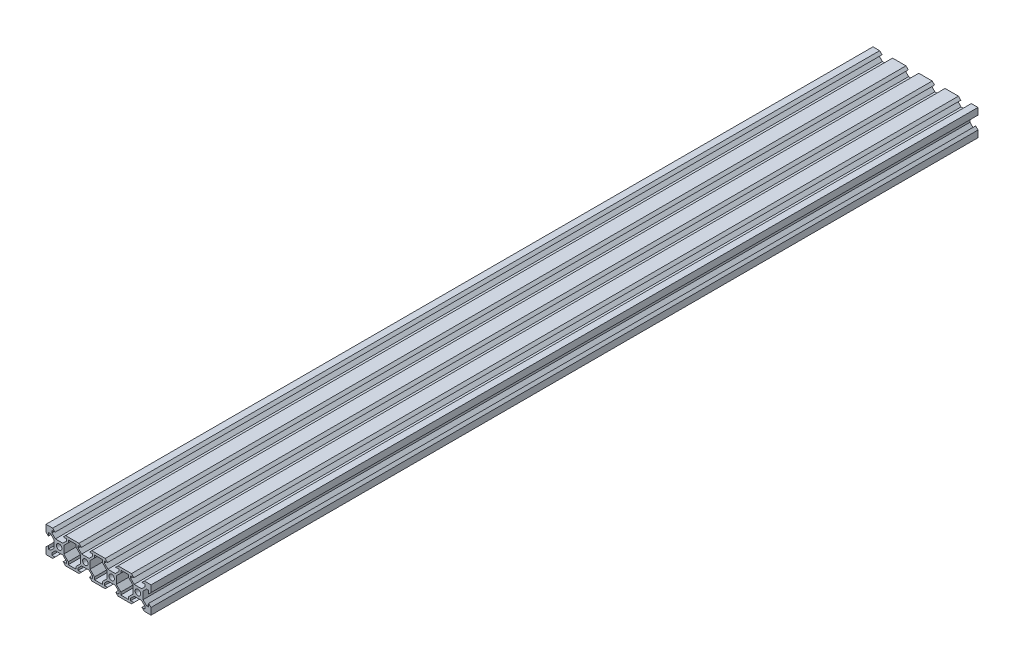
from build123d import *

# Parameters (mm, degrees)
ESQUISSE1_W             = 80
ESQUISSE1_H             = 20
BOSS_EXTRU_1_DEPTH      = 630
ENL_V_MAT_EXTRU_1_REACH = 635.518
ESQUISSE2_R             = 2.1
ENL_V_MAT_EXTRU_2_REACH = 635.518


with BuildPart() as part:
    # Esquisse1 → Boss.-Extru.1 (new body)
    with BuildSketch(Plane.XY):
        with Locations((-25.62771875, -1.733873274)):
            Rectangle(ESQUISSE1_W, ESQUISSE1_H)
    extrude(amount=BOSS_EXTRU_1_DEPTH)

    # Esquisse2 → Enlèv. mat.-Extru.1 (cut, up to next)
    with BuildSketch(Plane(origin=(0, 0, 0), x_dir=(-1, 0, 0), z_dir=(0, 0, -1)), mode=Mode.PRIVATE) as enl_v_mat_extru_1_sk1:
        with Locations((55.62771875, -1.733873274)):
            Circle(ESQUISSE2_R)
    enl_v_mat_extru_1_tool1 = extrude(enl_v_mat_extru_1_sk1.sketch, amount=-ENL_V_MAT_EXTRU_1_REACH, mode=Mode.PRIVATE) & part.part
    # Esquisse2 → Enlèv. mat.-Extru.1 (cut, up to next)
    with BuildSketch(Plane(origin=(0, 0, 0), x_dir=(-1, 0, 0), z_dir=(0, 0, -1)), mode=Mode.PRIVATE) as enl_v_mat_extru_1_sk2:
        with Locations((35.62771875, -1.733873274)):
            Circle(ESQUISSE2_R)
    enl_v_mat_extru_1_tool2 = extrude(enl_v_mat_extru_1_sk2.sketch, amount=-ENL_V_MAT_EXTRU_1_REACH, mode=Mode.PRIVATE) & part.part
    # Esquisse2 → Enlèv. mat.-Extru.1 (cut, up to next)
    with BuildSketch(Plane(origin=(0, 0, 0), x_dir=(-1, 0, 0), z_dir=(0, 0, -1)), mode=Mode.PRIVATE) as enl_v_mat_extru_1_sk3:
        with Locations((15.62771875, -1.733873274)):
            Circle(ESQUISSE2_R)
    enl_v_mat_extru_1_tool3 = extrude(enl_v_mat_extru_1_sk3.sketch, amount=-ENL_V_MAT_EXTRU_1_REACH, mode=Mode.PRIVATE) & part.part
    # Esquisse2 → Enlèv. mat.-Extru.1 (cut, up to next)
    with BuildSketch(Plane(origin=(0, 0, 0), x_dir=(-1, 0, 0), z_dir=(0, 0, -1)), mode=Mode.PRIVATE) as enl_v_mat_extru_1_sk4:
        with Locations((-4.37228125, -1.733873274)):
            Circle(ESQUISSE2_R)
    enl_v_mat_extru_1_tool4 = extrude(enl_v_mat_extru_1_sk4.sketch, amount=-ENL_V_MAT_EXTRU_1_REACH, mode=Mode.PRIVATE) & part.part
    # Esquisse2 → Enlèv. mat.-Extru.1 (cut, up to next)
    with BuildSketch(Plane(origin=(0, 0, 0), x_dir=(-1, 0, 0), z_dir=(0, 0, -1)), mode=Mode.PRIVATE) as enl_v_mat_extru_1_sk5:
        Polygon((50.72771875, 8.266126726), (60.52771875, 8.266126726), (58.72771875, 6.466126726), (61.12771875, 6.466126726), (61.12771875, 4.826126726), (58.46771875, 2.166126726), (52.78771875, 2.166126726), (50.12771875, 4.826126726), (50.12771875, 6.466126726), (52.52771875, 6.466126726), align=None)
    enl_v_mat_extru_1_tool5 = extrude(enl_v_mat_extru_1_sk5.sketch, amount=-ENL_V_MAT_EXTRU_1_REACH, mode=Mode.PRIVATE) & part.part
    # Esquisse2 → Enlèv. mat.-Extru.1 (cut, up to next)
    with BuildSketch(Plane(origin=(0, 0, 0), x_dir=(-1, 0, 0), z_dir=(0, 0, -1)), mode=Mode.PRIVATE) as enl_v_mat_extru_1_sk6:
        Polygon((65.62771875, 3.166126726), (65.62771875, -6.633873274), (63.82771875, -4.833873274), (63.82771875, -7.233873274), (62.18771875, -7.233873274), (59.52771875, -4.573873274), (59.52771875, 1.106126726), (62.18771875, 3.766126726), (63.82771875, 3.766126726), (63.82771875, 1.366126726), align=None)
    enl_v_mat_extru_1_tool6 = extrude(enl_v_mat_extru_1_sk6.sketch, amount=-ENL_V_MAT_EXTRU_1_REACH, mode=Mode.PRIVATE) & part.part
    # Esquisse2 → Enlèv. mat.-Extru.1 (cut, up to next)
    with BuildSketch(Plane(origin=(0, 0, 0), x_dir=(-1, 0, 0), z_dir=(0, 0, -1)), mode=Mode.PRIVATE) as enl_v_mat_extru_1_sk7:
        Polygon((60.52771875, -11.733873274), (50.72771875, -11.733873274), (52.52771875, -9.933873274), (50.12771875, -9.933873274), (50.12771875, -8.293873274), (52.78771875, -5.633873274), (58.46771875, -5.633873274), (61.12771875, -8.293873274), (61.12771875, -9.933873274), (58.72771875, -9.933873274), align=None)
    enl_v_mat_extru_1_tool7 = extrude(enl_v_mat_extru_1_sk7.sketch, amount=-ENL_V_MAT_EXTRU_1_REACH, mode=Mode.PRIVATE) & part.part
    # Esquisse2 → Enlèv. mat.-Extru.1 (cut, up to next)
    with BuildSketch(Plane(origin=(0, 0, 0), x_dir=(-1, 0, 0), z_dir=(0, 0, -1)), mode=Mode.PRIVATE) as enl_v_mat_extru_1_sk8:
        Polygon((30.72771875, 8.266126726), (40.52771875, 8.266126726), (38.72771875, 6.466126726), (41.12771875, 6.466126726), (41.12771875, 4.826126726), (38.46771875, 2.166126726), (32.78771875, 2.166126726), (30.12771875, 4.826126726), (30.12771875, 6.466126726), (32.52771875, 6.466126726), align=None)
    enl_v_mat_extru_1_tool8 = extrude(enl_v_mat_extru_1_sk8.sketch, amount=-ENL_V_MAT_EXTRU_1_REACH, mode=Mode.PRIVATE) & part.part
    # Esquisse2 → Enlèv. mat.-Extru.1 (cut, up to next)
    with BuildSketch(Plane(origin=(0, 0, 0), x_dir=(-1, 0, 0), z_dir=(0, 0, -1)), mode=Mode.PRIVATE) as enl_v_mat_extru_1_sk9:
        Polygon((40.52771875, -11.733873274), (30.72771875, -11.733873274), (32.52771875, -9.933873274), (30.12771875, -9.933873274), (30.12771875, -8.293873274), (32.78771875, -5.633873274), (38.46771875, -5.633873274), (41.12771875, -8.293873274), (41.12771875, -9.933873274), (38.72771875, -9.933873274), align=None)
    enl_v_mat_extru_1_tool9 = extrude(enl_v_mat_extru_1_sk9.sketch, amount=-ENL_V_MAT_EXTRU_1_REACH, mode=Mode.PRIVATE) & part.part
    # Esquisse2 → Enlèv. mat.-Extru.1 (cut, up to next)
    with BuildSketch(Plane(origin=(0, 0, 0), x_dir=(-1, 0, 0), z_dir=(0, 0, -1)), mode=Mode.PRIVATE) as enl_v_mat_extru_1_sk10:
        Polygon((10.72771875, 8.266126726), (20.52771875, 8.266126726), (18.72771875, 6.466126726), (21.12771875, 6.466126726), (21.12771875, 4.826126726), (18.46771875, 2.166126726), (12.78771875, 2.166126726), (10.12771875, 4.826126726), (10.12771875, 6.466126726), (12.52771875, 6.466126726), align=None)
    enl_v_mat_extru_1_tool10 = extrude(enl_v_mat_extru_1_sk10.sketch, amount=-ENL_V_MAT_EXTRU_1_REACH, mode=Mode.PRIVATE) & part.part
    # Esquisse2 → Enlèv. mat.-Extru.1 (cut, up to next)
    with BuildSketch(Plane(origin=(0, 0, 0), x_dir=(-1, 0, 0), z_dir=(0, 0, -1)), mode=Mode.PRIVATE) as enl_v_mat_extru_1_sk11:
        Polygon((20.52771875, -11.733873274), (10.72771875, -11.733873274), (12.52771875, -9.933873274), (10.12771875, -9.933873274), (10.12771875, -8.293873274), (12.78771875, -5.633873274), (18.46771875, -5.633873274), (21.12771875, -8.293873274), (21.12771875, -9.933873274), (18.72771875, -9.933873274), align=None)
    enl_v_mat_extru_1_tool11 = extrude(enl_v_mat_extru_1_sk11.sketch, amount=-ENL_V_MAT_EXTRU_1_REACH, mode=Mode.PRIVATE) & part.part
    # Esquisse2 → Enlèv. mat.-Extru.1 (cut, up to next)
    with BuildSketch(Plane(origin=(0, 0, 0), x_dir=(-1, 0, 0), z_dir=(0, 0, -1)), mode=Mode.PRIVATE) as enl_v_mat_extru_1_sk12:
        Polygon((-9.27228125, 8.266126726), (0.52771875, 8.266126726), (-1.27228125, 6.466126726), (1.12771875, 6.466126726), (1.12771875, 4.826126726), (-1.53228125, 2.166126726), (-7.21228125, 2.166126726), (-9.87228125, 4.826126726), (-9.87228125, 6.466126726), (-7.47228125, 6.466126726), align=None)
    enl_v_mat_extru_1_tool12 = extrude(enl_v_mat_extru_1_sk12.sketch, amount=-ENL_V_MAT_EXTRU_1_REACH, mode=Mode.PRIVATE) & part.part
    # Esquisse2 → Enlèv. mat.-Extru.1 (cut, up to next)
    with BuildSketch(Plane(origin=(0, 0, 0), x_dir=(-1, 0, 0), z_dir=(0, 0, -1)), mode=Mode.PRIVATE) as enl_v_mat_extru_1_sk13:
        Polygon((0.52771875, -11.733873274), (-9.27228125, -11.733873274), (-7.47228125, -9.933873274), (-9.87228125, -9.933873274), (-9.87228125, -8.293873274), (-7.21228125, -5.633873274), (-1.53228125, -5.633873274), (1.12771875, -8.293873274), (1.12771875, -9.933873274), (-1.27228125, -9.933873274), align=None)
    enl_v_mat_extru_1_tool13 = extrude(enl_v_mat_extru_1_sk13.sketch, amount=-ENL_V_MAT_EXTRU_1_REACH, mode=Mode.PRIVATE) & part.part
    # Esquisse2 → Enlèv. mat.-Extru.1 (cut, up to next)
    with BuildSketch(Plane(origin=(0, 0, 0), x_dir=(-1, 0, 0), z_dir=(0, 0, -1)), mode=Mode.PRIVATE) as enl_v_mat_extru_1_sk14:
        Polygon((-14.37228125, -6.633873274), (-14.37228125, 3.166126726), (-12.57228125, 1.366126726), (-12.57228125, 3.766126726), (-10.93228125, 3.766126726), (-8.27228125, 1.106126726), (-8.27228125, -4.573873274), (-10.93228125, -7.233873274), (-12.57228125, -7.233873274), (-12.57228125, -4.833873274), align=None)
    enl_v_mat_extru_1_tool14 = extrude(enl_v_mat_extru_1_sk14.sketch, amount=-ENL_V_MAT_EXTRU_1_REACH, mode=Mode.PRIVATE) & part.part
    add(enl_v_mat_extru_1_tool1.solids().sort_by_distance((-55.627719, -1.733873, 0))[0], mode=Mode.SUBTRACT)
    add(enl_v_mat_extru_1_tool2.solids().sort_by_distance((-35.627719, -1.733873, 0))[0], mode=Mode.SUBTRACT)
    add(enl_v_mat_extru_1_tool3.solids().sort_by_distance((-15.627719, -1.733873, 0))[0], mode=Mode.SUBTRACT)
    add(enl_v_mat_extru_1_tool4.solids().sort_by_distance((4.372281, -1.733873, 0))[0], mode=Mode.SUBTRACT)
    add(enl_v_mat_extru_1_tool5.solids().sort_by_distance((-55.627719, 5.301599, 0))[0], mode=Mode.SUBTRACT)
    add(enl_v_mat_extru_1_tool6.solids().sort_by_distance((-62.663191, -1.733873, 0))[0], mode=Mode.SUBTRACT)
    add(enl_v_mat_extru_1_tool7.solids().sort_by_distance((-55.627719, -8.769346, 0))[0], mode=Mode.SUBTRACT)
    add(enl_v_mat_extru_1_tool8.solids().sort_by_distance((-35.627719, 5.301599, 0))[0], mode=Mode.SUBTRACT)
    add(enl_v_mat_extru_1_tool9.solids().sort_by_distance((-35.627719, -8.769346, 0))[0], mode=Mode.SUBTRACT)
    add(enl_v_mat_extru_1_tool10.solids().sort_by_distance((-15.627719, 5.301599, 0))[0], mode=Mode.SUBTRACT)
    add(enl_v_mat_extru_1_tool11.solids().sort_by_distance((-15.627719, -8.769346, 0))[0], mode=Mode.SUBTRACT)
    add(enl_v_mat_extru_1_tool12.solids().sort_by_distance((4.372281, 5.301599, 0))[0], mode=Mode.SUBTRACT)
    add(enl_v_mat_extru_1_tool13.solids().sort_by_distance((4.372281, -8.769346, 0))[0], mode=Mode.SUBTRACT)
    add(enl_v_mat_extru_1_tool14.solids().sort_by_distance((11.407754, -1.733873, 0))[0], mode=Mode.SUBTRACT)

    # Esquisse3 → Enlèv. mat.-Extru.2 (cut, up to next)
    with BuildSketch(Plane(origin=(0, 0, 0), x_dir=(-1, 0, 0), z_dir=(0, 0, -1)), mode=Mode.PRIVATE) as enl_v_mat_extru_2_sk1:
        Polygon((2.618256699, 6.466126726), (8.637180802, 6.466126726), (8.637180802, 4.506126726), (12.037180802, 1.106126726), (12.037180802, -4.573873274), (8.637180802, -7.973873274), (8.637180802, -9.933873274), (2.618256699, -9.933873274), (2.618256699, -7.973873274), (-0.781743301, -4.573873274), (-0.781743301, 1.106126726), (2.618256699, 4.506126726), align=None)
    enl_v_mat_extru_2_tool1 = extrude(enl_v_mat_extru_2_sk1.sketch, amount=-ENL_V_MAT_EXTRU_2_REACH, mode=Mode.PRIVATE) & part.part
    # Esquisse3 → Enlèv. mat.-Extru.2 (cut, up to next)
    with BuildSketch(Plane(origin=(0, 0, 0), x_dir=(-1, 0, 0), z_dir=(0, 0, -1)), mode=Mode.PRIVATE) as enl_v_mat_extru_2_sk2:
        Polygon((22.618256699, 6.466126726), (28.637180802, 6.466126726), (28.637180802, 4.506126726), (32.037180802, 1.106126726), (32.037180802, -4.573873274), (28.637180802, -7.973873274), (28.637180802, -9.933873274), (22.618256699, -9.933873274), (22.618256699, -7.973873274), (19.218256699, -4.573873274), (19.218256699, 1.106126726), (22.618256699, 4.506126726), align=None)
    enl_v_mat_extru_2_tool2 = extrude(enl_v_mat_extru_2_sk2.sketch, amount=-ENL_V_MAT_EXTRU_2_REACH, mode=Mode.PRIVATE) & part.part
    # Esquisse3 → Enlèv. mat.-Extru.2 (cut, up to next)
    with BuildSketch(Plane(origin=(0, 0, 0), x_dir=(-1, 0, 0), z_dir=(0, 0, -1)), mode=Mode.PRIVATE) as enl_v_mat_extru_2_sk3:
        Polygon((42.618256699, 6.466126726), (48.637180802, 6.466126726), (48.637180802, 4.506126726), (52.037180802, 1.106126726), (52.037180802, -4.573873274), (48.637180802, -7.973873274), (48.637180802, -9.933873274), (42.618256699, -9.933873274), (42.618256699, -7.973873274), (39.218256699, -4.573873274), (39.218256699, 1.106126726), (42.618256699, 4.506126726), align=None)
    enl_v_mat_extru_2_tool3 = extrude(enl_v_mat_extru_2_sk3.sketch, amount=-ENL_V_MAT_EXTRU_2_REACH, mode=Mode.PRIVATE) & part.part
    add(enl_v_mat_extru_2_tool1.solids().sort_by_distance((-5.627719, -1.733873, 0))[0], mode=Mode.SUBTRACT)
    add(enl_v_mat_extru_2_tool2.solids().sort_by_distance((-25.627719, -1.733873, 0))[0], mode=Mode.SUBTRACT)
    add(enl_v_mat_extru_2_tool3.solids().sort_by_distance((-45.627719, -1.733873, 0))[0], mode=Mode.SUBTRACT)


solid = part.part
